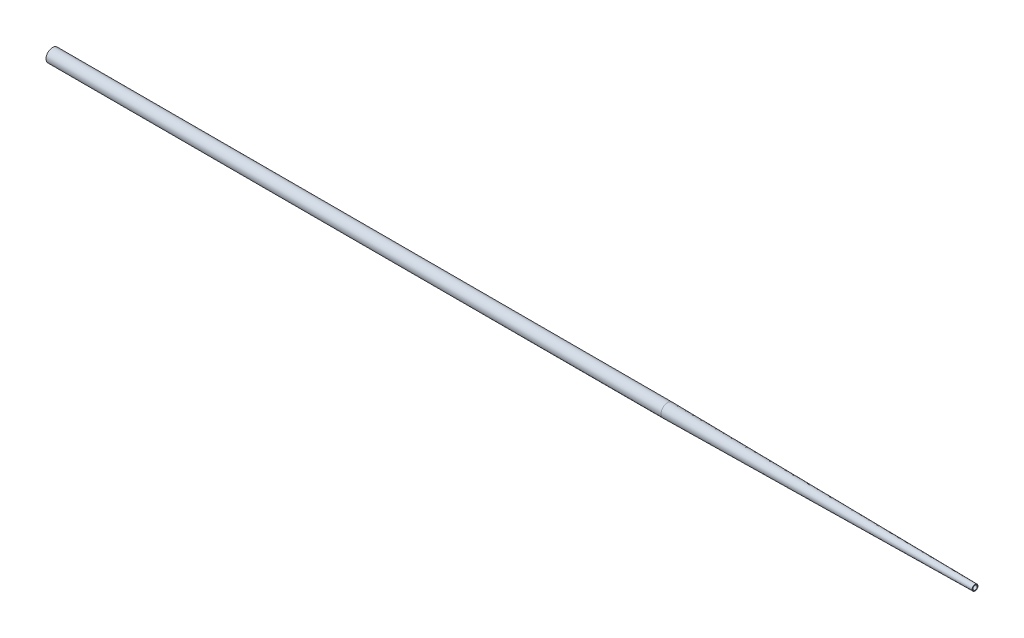
from build123d import *


with BuildPart() as part:
    # Sketch1 → Revolve1 (revolve)
    with BuildSketch(Plane(origin=(0, 0, 0), x_dir=(1, 0, 0), z_dir=(0, 1, 0)), mode=Mode.PRIVATE) as revolve1_sk:
        Polygon((-225.350528016, 22.514214767), (-225.350528016, 21.514214767), (574.649471984, 21.514214767), (974.649471984, 16.79223425), (974.649471984, 17.79223425), (574.649471984, 22.514214767), align=None)
    revolve(revolve1_sk.sketch.rotate(Axis((-229.207509754, 0, -14.014214767), (1, 0, 0)), 180), axis=Axis((-229.207509754, 0, -14.014214767), (1, 0, 0)))


solid = part.part
